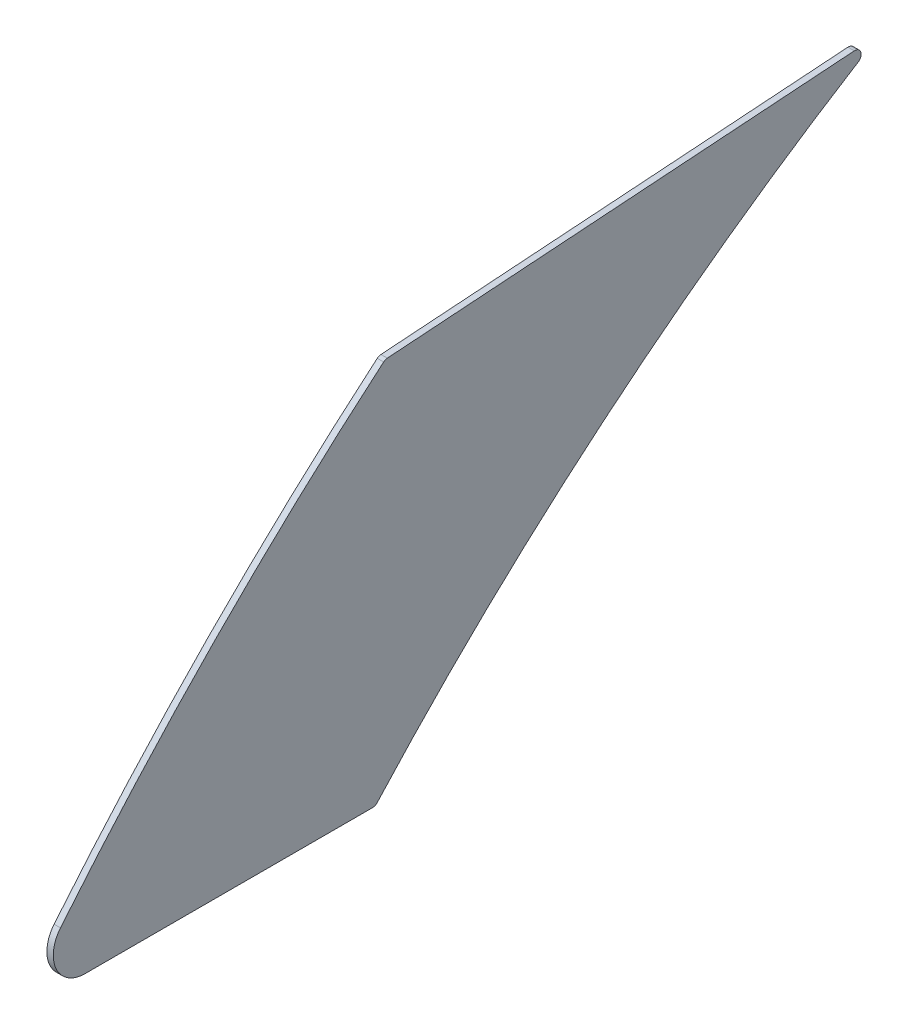
from build123d import *

# Parameters (mm, degrees)
BOSS_EXTRUDE1_DEPTH = 1


with BuildPart() as part:
    # Sketch1 → Boss-Extrude1 (new body)
    with BuildSketch(Plane(origin=(0, 0, 0), x_dir=(0, 0, -1), z_dir=(1, 0, 0))):
        with BuildLine():
            Line((0.326528995, 0.022833132), (73.71668331, 5.154772651))
            ThreePointArc((73.71668331, 5.154772651), (74.738227658, 4.463965576), (74.312324158, 3.306652533))
            ThreePointArc((74.312324158, 3.306652533), (34.303458398, -25.51373755), (-1.258199843, -59.670621001))
            ThreePointArc((-1.258199843, -59.670621001), (-1.594180459, -59.913953227), (-2, -60))
            Line((-2, -60), (-47.16876351, -60))
            ThreePointArc((-47.16876351, -60), (-51.688068324, -57.139131599), (-51.035718603, -51.8303536))
            ThreePointArc((-51.035718603, -51.8303536), (-26.813414366, -24.869459397), (-0.250141607, -0.211755142))
            ThreePointArc((-0.250141607, -0.211755142), (0.019473004, -0.048441349), (0.326528995, 0.022833132))
        make_face()
    extrude(amount=BOSS_EXTRUDE1_DEPTH)


solid = part.part
